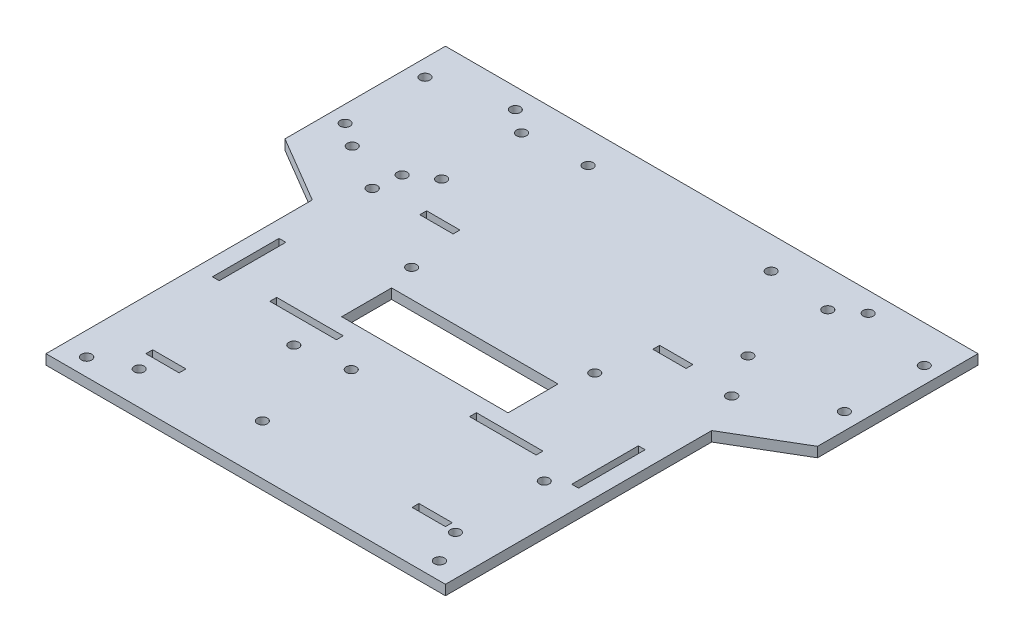
from build123d import *

# Parameters (mm, degrees)
SKETCH1_W           = 120
SKETCH1_H           = 140
BOSS_EXTRUDE1_DEPTH = 3
SKETCH2_R           = 1.5
CUT_EXTRUDE1_DEPTH  = 107.343782141
SKETCH3_R           = 1.5
CUT_EXTRUDE3_DEPTH  = 107.343782141
SKETCH4_R           = 1.5
CUT_EXTRUDE4_DEPTH  = 107.343782141
SKETCH5_R           = 1.5
CUT_EXTRUDE5_DEPTH  = 3
SKETCH6_R           = 1.525
SKETCH6_W           = 10
SKETCH6_H           = 2.05
SKETCH6_W_2         = 20
CUT_EXTRUDE7_DEPTH  = 107.343782141
SKETCH9_R           = 1.525
CUT_EXTRUDE8_DEPTH  = 3
SKETCH10_W          = 50
SKETCH10_H          = 15
CUT_EXTRUDE9_DEPTH  = 5
SKETCH11_R          = 1.5
CUT_EXTRUDE10_DEPTH = 5
SKETCH12_W          = 2.05
SKETCH12_H          = 20
CUT_EXTRUDE11_DEPTH = 10


with BuildPart() as part:
    # Sketch1 → Boss-Extrude1 (new body)
    with BuildSketch(Plane(origin=(0, 0, 0), x_dir=(1, 0, 0), z_dir=(0, 1, 0))):
        Rectangle(SKETCH1_W, SKETCH1_H)
        Polygon((-80, 21.791828604), (-60, 10), (-60, 70), (-80, 70), align=None)
        Polygon((80, 70), (60, 70), (60, 10), (80, 21.791828604), align=None)
    extrude(amount=BOSS_EXTRUDE1_DEPTH)

    # Sketch2 → Cut-Extrude1 (cut, through all)
    with BuildSketch(Plane(origin=(0, 3, 0), x_dir=(1, 0, 0), z_dir=(0, 1, 0))):
        with Locations(Location((-42, -60, 0), (0, 0, 270))):
            Circle(SKETCH2_R)
        with Locations(Location((-25, -30.555136271, 0), (0, 0, 270))):
            Circle(SKETCH2_R)
        with Locations(Location((-10, -55, 0), (0, 0, 270))):
            Circle(SKETCH2_R)
        with Locations(Location((48, -55, 0), (0, 0, 270))):
            Circle(SKETCH2_R)
        with Locations(Location((-10, -28.3, 0), (0, 0, 270))):
            Circle(SKETCH2_R)
        with Locations(Location((48, -28.3, 0), (0, 0, 270))):
            Circle(SKETCH2_R)
    extrude(amount=-CUT_EXTRUDE1_DEPTH, mode=Mode.SUBTRACT)

    # Sketch3 → Cut-Extrude3 (cut, through all)
    with BuildSketch(Plane(origin=(0, 3, 0), x_dir=(1, 0, 0), z_dir=(0, 1, 0))):
        with Locations(Location((-27.529579069, 60.385555627, 0), (0, 0, 270))):
            Circle(SKETCH3_R)
        with Locations(Location((-27.529579069, 7.385555627, 0), (0, 0, 90))):
            Circle(SKETCH3_R)
        with Locations(Location((27.470420931, 7.385555627, 0), (0, 0, 270))):
            Circle(SKETCH3_R)
        with Locations(Location((27.470420931, 60.385555627, 0), (0, 0, 90))):
            Circle(SKETCH3_R)
    extrude(amount=-CUT_EXTRUDE3_DEPTH, mode=Mode.SUBTRACT)

    # Sketch4 → Cut-Extrude4 (cut, through all)
    with BuildSketch(Plane(origin=(0, 3, 0), x_dir=(1, 0, 0), z_dir=(0, 1, 0))):
        with Locations(Location((-75, 34.863883517, 0), (0, 0, 270))):
            Circle(SKETCH4_R)
        with Locations(Location((-75, 58.863883517, 0), (0, 0, 270))):
            Circle(SKETCH4_R)
        with Locations(Location((-46, 34.863883517, 0), (0, 0, 90))):
            Circle(SKETCH4_R)
        with Locations(Location((-46, 58.863883517, 0), (0, 0, 90))):
            Circle(SKETCH4_R)
        with Locations(Location((46, 58.863883517, 0), (0, 0, 270))):
            Circle(SKETCH4_R)
        with Locations(Location((46, 34.863883517, 0), (0, 0, 270))):
            Circle(SKETCH4_R)
        with Locations(Location((75, 34.863883517, 0), (0, 0, 90))):
            Circle(SKETCH4_R)
        with Locations(Location((75, 58.863883517, 0), (0, 0, 90))):
            Circle(SKETCH4_R)
    extrude(amount=-CUT_EXTRUDE4_DEPTH, mode=Mode.SUBTRACT)

    # Sketch5 → Cut-Extrude5 (cut)
    with BuildSketch(Plane(origin=(0, 3, 0), x_dir=(1, 0, 0), z_dir=(0, 1, 0))):
        with Locations(Location((-68, 30, 0), (0, 0, 270))):
            Circle(SKETCH5_R)
        with Locations(Location((-53, 30, 0), (0, 0, 270))):
            Circle(SKETCH5_R)
    extrude(amount=-CUT_EXTRUDE5_DEPTH, mode=Mode.SUBTRACT)

    # Sketch6 → Cut-Extrude7 (cut, through all)
    with BuildSketch(Plane(origin=(0, 3, 0), x_dir=(1, 0, 0), z_dir=(0, 1, 0))):
        with Locations(Location((-53, -64.8, 0), (0, 0, 270))):
            Circle(SKETCH6_R)
        with Locations(Location((53, -64.8, 0), (0, 0, 90))):
            Circle(SKETCH6_R)
        with Locations((-40, -53.975)):
            Rectangle(SKETCH6_W, SKETCH6_H)
        with Locations((40, -53.975)):
            Rectangle(SKETCH6_W, SKETCH6_H)
        with Locations((30, -21.725)):
            Rectangle(SKETCH6_W_2, SKETCH6_H)
        with Locations((-30, -21.725)):
            Rectangle(SKETCH6_W_2, SKETCH6_H)
        with Locations((35, 23.325)):
            Rectangle(SKETCH6_W, SKETCH6_H)
        with Locations((-35, 23.325)):
            Rectangle(SKETCH6_W, SKETCH6_H)
    extrude(amount=-CUT_EXTRUDE7_DEPTH, mode=Mode.SUBTRACT)

    # Sketch9 → Cut-Extrude8 (cut)
    with BuildSketch(Plane(origin=(0, 3, 0), x_dir=(1, 0, 0), z_dir=(0, 1, 0))):
        with Locations(Location((-54, 22, 0), (0, 0, 270))):
            Circle(SKETCH9_R)
        with Locations(Location((54, 22, 0), (0, 0, 90))):
            Circle(SKETCH9_R)
    extrude(amount=-CUT_EXTRUDE8_DEPTH, mode=Mode.SUBTRACT)

    # Sketch10 → Cut-Extrude9 (cut)
    with BuildSketch(Plane(origin=(0, 3, 0), x_dir=(1, 0, 0), z_dir=(0, 1, 0))):
        with Locations((-0.2, -8.475074484)):
            Rectangle(SKETCH10_W, SKETCH10_H)
    extrude(amount=-CUT_EXTRUDE9_DEPTH, mode=Mode.SUBTRACT)

    # Sketch11 → Cut-Extrude10 (cut)
    with BuildSketch(Plane(origin=(0, 3, 0), x_dir=(1, 0, 0), z_dir=(0, 1, 0))):
        with Locations(Location((-53, 64, 0), (0, 0, 270))):
            Circle(SKETCH11_R)
        with Locations(Location((53, 64, 0), (0, 0, 270))):
            Circle(SKETCH11_R)
    extrude(amount=-CUT_EXTRUDE10_DEPTH, mode=Mode.SUBTRACT)

    # Sketch12 → Cut-Extrude11 (cut)
    with BuildSketch(Plane(origin=(0, 3, 0), x_dir=(1, 0, 0), z_dir=(0, 1, 0))):
        with Locations((-53.975, -15)):
            Rectangle(SKETCH12_W, SKETCH12_H)
        with Locations((53.975, -15)):
            Rectangle(SKETCH12_W, SKETCH12_H)
    extrude(amount=-CUT_EXTRUDE11_DEPTH, mode=Mode.SUBTRACT)


solid = part.part
